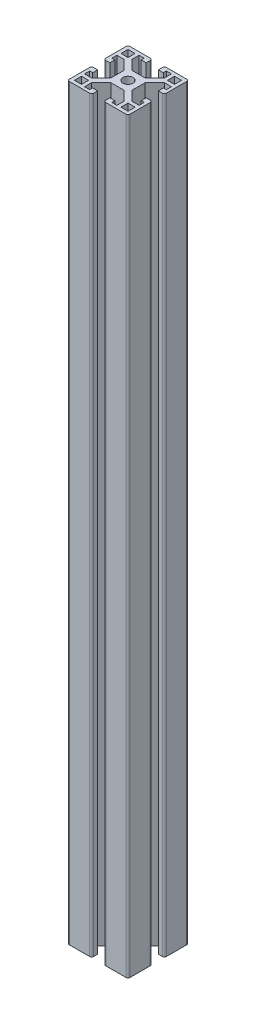
from build123d import *

# Parameters (mm, degrees)
SKETCH1_R           = 2.5
SKETCH1_W           = 3.5
SKETCH1_H           = 3.5
BOSS_EXTRUDE1_DEPTH = 370
FILLET1_R           = 1


with BuildPart() as part:
    # Sketch1 → Boss-Extrude1 (new body)
    with BuildSketch(Plane(origin=(0, 0, 0), x_dir=(1, 0, 0), z_dir=(0, 1, 0))):
        Polygon((-15, 7.5), (-15, -4.5), (-12, -4.5), (-12, -2), (-13.5, -2), (-13.5, 0.5), (-10, 0.5), (-5.25, -4.25), (-5.25, -10.75), (-10, -15.5), (-13.5, -15.5), (-13.5, -13), (-12, -13), (-12, -10.5), (-15, -10.5), (-15, -22.5), (-3, -22.5), (-3, -19.5), (-5.5, -19.5), (-5.5, -21), (-8, -21), (-8, -17.5), (-3.25, -12.75), (3.25, -12.75), (8, -17.5), (8, -21), (5.5, -21), (5.5, -19.5), (3, -19.5), (3, -22.5), (15, -22.5), (15, -10.5), (12, -10.5), (12, -13), (13.5, -13), (13.5, -15.5), (10, -15.5), (5.25, -10.75), (5.25, -4.25), (10, 0.5), (13.5, 0.5), (13.5, -2), (12, -2), (12, -4.5), (15, -4.5), (15, 7.5), (3, 7.5), (3, 4.5), (5.5, 4.5), (5.5, 6), (8, 6), (8, 2.5), (3.25, -2.25), (-3.25, -2.25), (-8, 2.5), (-8, 6), (-5.5, 6), (-5.5, 4.5), (-3, 4.5), (-3, 7.5), align=None)
        with Locations(Location((0, -7.5, 0), (0, 0, 270))):
            Circle(SKETCH1_R, mode=Mode.SUBTRACT)
        with Locations((-11.5, 4)):
            Rectangle(SKETCH1_W, SKETCH1_H, mode=Mode.SUBTRACT)
        with Locations((11.5, 4)):
            Rectangle(SKETCH1_W, SKETCH1_H, mode=Mode.SUBTRACT)
        with Locations((11.5, -19)):
            Rectangle(SKETCH1_W, SKETCH1_H, mode=Mode.SUBTRACT)
        with Locations((-11.5, -19)):
            Rectangle(SKETCH1_W, SKETCH1_H, mode=Mode.SUBTRACT)
    extrude(amount=-BOSS_EXTRUDE1_DEPTH)

    # Fillet1
    fillet1_edges = [part.edges().sort_by_distance(p)[0] for p in [
        (15, -185, 10.5),
        (15, -185, 22.5),
        (3, -185, 22.5),
        (-3, -185, 22.5),
        (-15, -185, 22.5),
        (-15, -185, 10.5),
        (-15, -185, 4.5),
        (-15, -185, -7.5),
        (-3, -185, -7.5),
        (3, -185, -7.5),
        (15, -185, -7.5),
        (15, -185, 4.5),
    ]]
    fillet(fillet1_edges, radius=FILLET1_R)


solid = part.part
